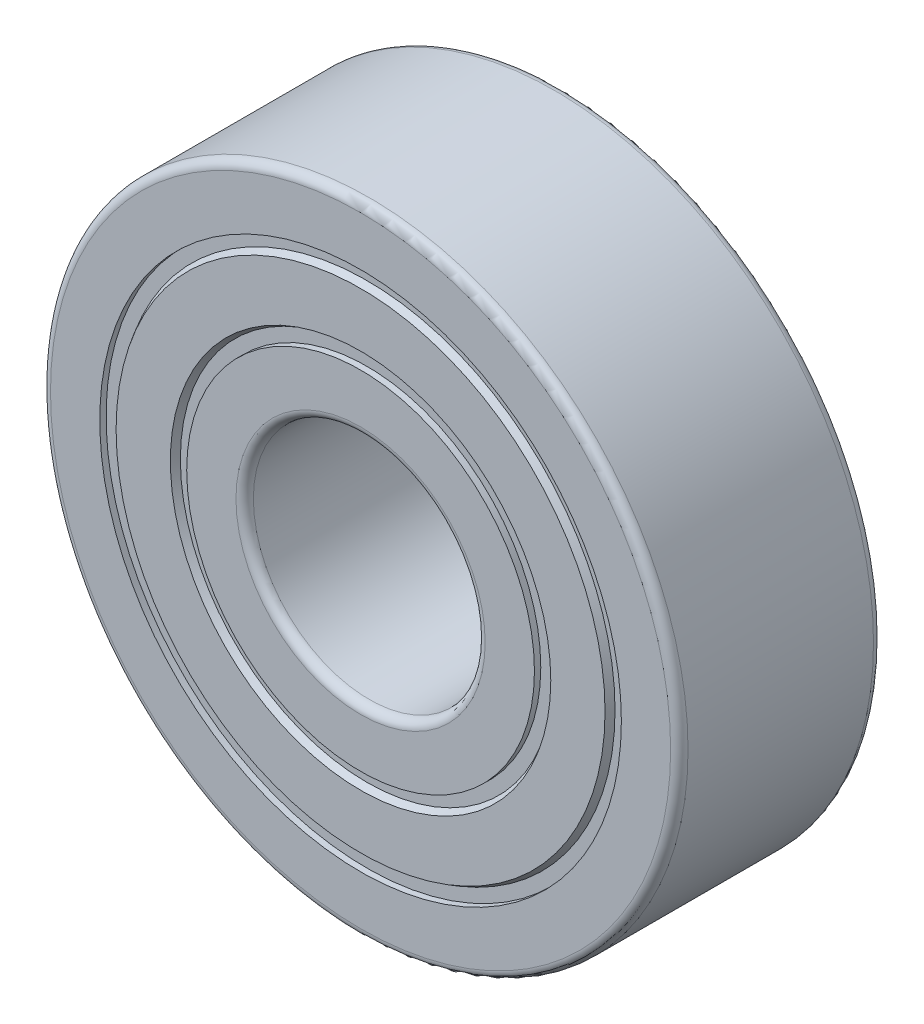
from build123d import *

# Parameters (mm, degrees)
SKETCH2_R = 2.1875


with BuildPart() as part:
    # Sketch2 → Base-Revolve (revolve)
    with BuildSketch(Plane(origin=(0, 0, 0), x_dir=(1, 0, 0), z_dir=(0, 1, 0)), mode=Mode.PRIVATE) as base_revolve_sk:
        with BuildLine():
            Line((-9, 0), (-9, -0.21875))
            Line((-9, -0.21875), (-8.5625, -0.21875))
            Line((-8.5625, -0.21875), (-8.436204629, 0))
            Line((-8.436204629, 0), (-6.563795371, 0))
            Line((-6.563795371, 0), (-6.4375, -0.21875))
            Line((-6.4375, -0.21875), (-6, -0.21875))
            Line((-6, -0.21875), (-6, 0))
            Line((-6, 0), (-4.3, 0))
            ThreePointArc((-4.3, 0), (-4.087867966, -0.087867966), (-4, -0.3))
            Line((-4, -0.3), (-4, -6.7))
            ThreePointArc((-4, -6.7), (-4.087867966, -6.912132034), (-4.3, -7))
            Line((-4.3, -7), (-6, -7))
            Line((-6, -7), (-6, -6.78125))
            Line((-6, -6.78125), (-6.4375, -6.78125))
            Line((-6.4375, -6.78125), (-6.563795371, -7))
            Line((-6.563795371, -7), (-8.436204629, -7))
            Line((-8.436204629, -7), (-8.5625, -6.78125))
            Line((-8.5625, -6.78125), (-9, -6.78125))
            Line((-9, -6.78125), (-9, -7))
            Line((-9, -7), (-10.7, -7))
            ThreePointArc((-10.7, -7), (-10.912132034, -6.912132034), (-11, -6.7))
            Line((-11, -6.7), (-11, -0.3))
            ThreePointArc((-11, -0.3), (-10.912132034, -0.087867966), (-10.7, 0))
            Line((-10.7, 0), (-9, 0))
        make_face()
        with Locations((-7.5, -3.5)):
            Circle(SKETCH2_R, mode=Mode.SUBTRACT)
    revolve(base_revolve_sk.sketch.rotate(Axis((0, 0, 19), (0, 0, -1)), 180), axis=Axis((0, 0, 19), (0, 0, -1)))


solid = part.part
